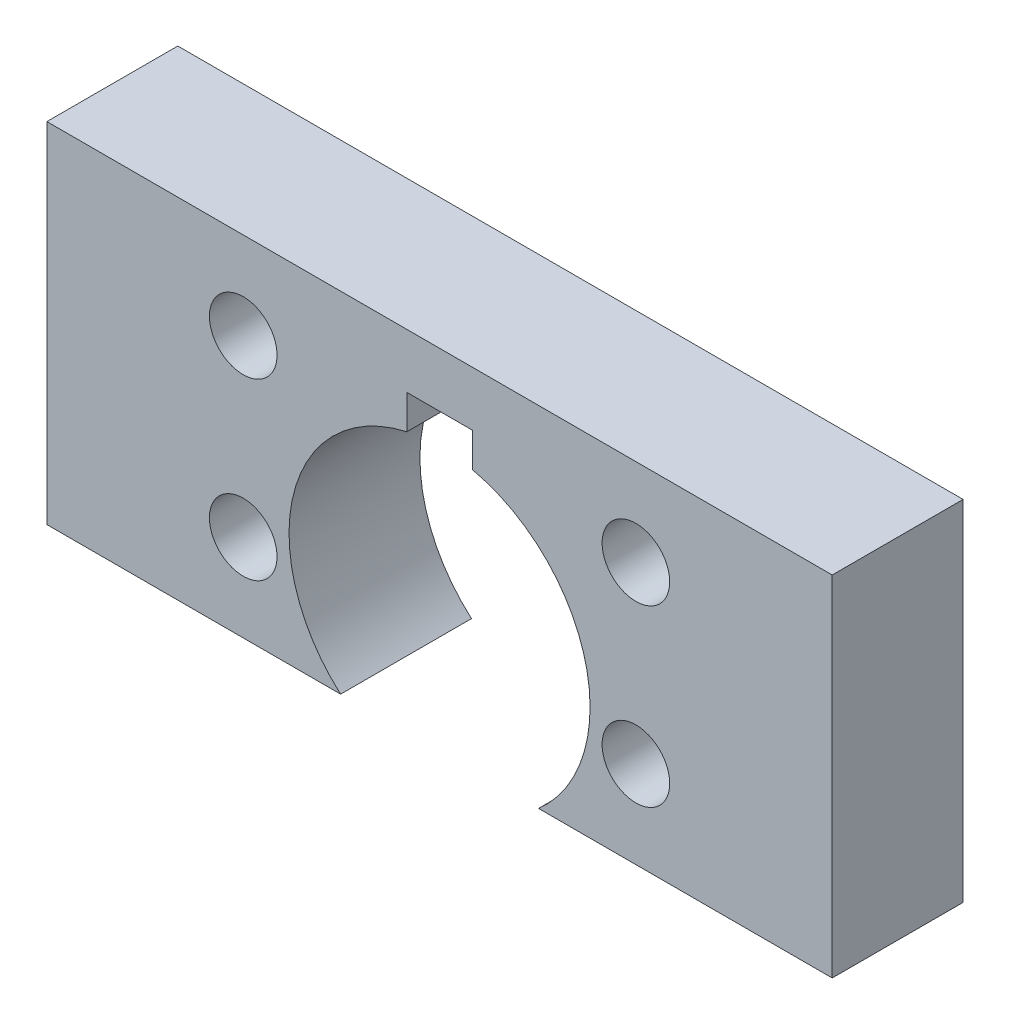
from build123d import *

# Parameters (mm, degrees)
SZKIC1_W                    = 36
SZKIC1_H                    = 16
DODANIE_WYCI_GNI_CIE1_DEPTH = 6
WYTNIJ_WYCI_GNI_CIE1_DEPTH  = 6
SZKIC3_R                    = 1.55
WYTNIJ_WYCI_GNI_CIE2_DEPTH  = 74.51650454


with BuildPart() as part:
    # Szkic1 → Dodanie-wyciągnięcie1 (new body)
    with BuildSketch(Plane.XY):
        with Locations((53.502982034, -8)):
            Rectangle(SZKIC1_W, SZKIC1_H)
    extrude(amount=-DODANIE_WYCI_GNI_CIE1_DEPTH)

    # Szkic2 → Wytnij-wyciągnięcie1 (cut)
    with BuildSketch(Plane.XY):
        with BuildLine():
            Line((55.002982034, -4.065016704), (55.002982034, -2.5))
            Line((55.002982034, -2.5), (52.002982034, -2.5))
            Line((52.002982034, -2.5), (52.002982034, -4.065016704))
            ThreePointArc((52.002982034, -4.065016704), (46.727022487, -9.497551457), (49.612982034, -16.498938498))
            Line((49.612982034, -16.498938498), (49.612982034, -16))
            Line((49.612982034, -16), (57.392982034, -16))
            Line((57.392982034, -16), (57.392982034, -16.498938498))
            ThreePointArc((57.392982034, -16.498938498), (60.278941582, -9.497551457), (55.002982034, -4.065016704))
        make_face()
    extrude(amount=-WYTNIJ_WYCI_GNI_CIE1_DEPTH, mode=Mode.SUBTRACT)

    # Szkic3 → Wytnij-wyciągnięcie2 (cut, through all)
    with BuildSketch(Plane(origin=(0, 0, -6), x_dir=(-1, 0, 0), z_dir=(0, 0, -1))):
        with Locations((-44.502982035, -12)):
            Circle(SZKIC3_R)
        with Locations((-44.502982035, -4)):
            Circle(SZKIC3_R)
        with Locations((-62.502982035, -4)):
            Circle(SZKIC3_R)
        with Locations((-62.502982035, -12)):
            Circle(SZKIC3_R)
    extrude(amount=-WYTNIJ_WYCI_GNI_CIE2_DEPTH, mode=Mode.SUBTRACT)


solid = part.part
